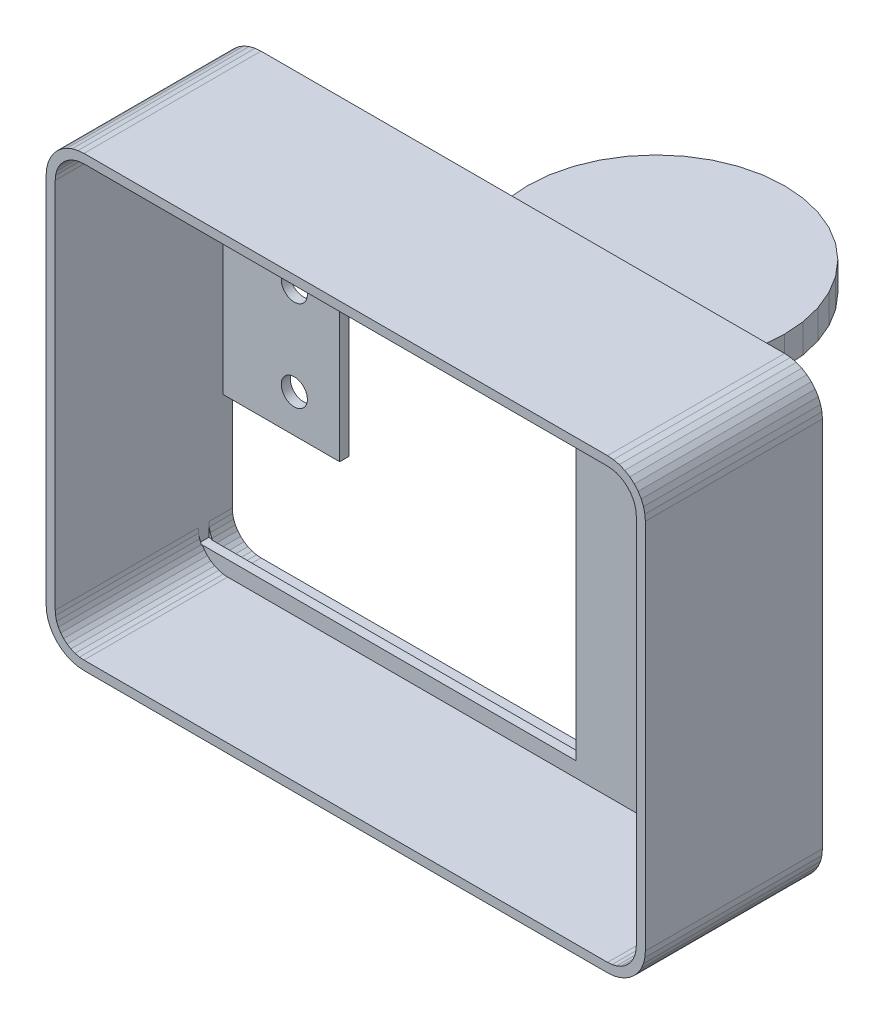
from build123d import *

# Parameters (mm, degrees)
BOSS_EXTRUDE1_START     = -23.4
BOSS_EXTRUDE1_DEPTH     = 23.4
CUT_EXTRUDE1_DEPTH      = 57.162977129
CUT_EXTRUDE1_DEPTH_BACK = 57.162977129
BOSS_EXTRUDE2_START     = -20.2
BOSS_EXTRUDE2_DEPTH     = 1.2
CUT_EXTRUDE2_START      = -20.3
SKETCH4_W               = 49.8
SKETCH4_H               = 38.8
CUT_EXTRUDE2_DEPTH      = 1.4
BOSS_EXTRUDE3_START     = -23.4
SKETCH5_W               = 15.4
SKETCH5_H               = 22
BOSS_EXTRUDE3_DEPTH     = 1.2
CUT_EXTRUDE3_DEPTH      = 57.162977129
CUT_EXTRUDE3_DEPTH_BACK = 57.162977129
SKETCH6_R               = 1.725
BOSS_EXTRUDE4_START     = 12.4
BOSS_EXTRUDE4_DEPTH     = 3.8
CUT_EXTRUDE4_START      = 13.65
CUT_EXTRUDE4_DEPTH      = 1.35


with BuildPart() as part:
    # Sketch1 → Boss-Extrude1 (new body)
    with BuildSketch(Plane.XY.offset(BOSS_EXTRUDE1_START)):
        Polygon((-41.6, -24.6), (-41.5384, -25.3822), (-41.3553, -26.1451), (-41.055, -26.87), (-40.6451, -27.5389), (-40.1355, -28.1355), (-39.5389, -28.6451), (-38.87, -29.055), (-38.1451, -29.3553), (-37.3822, -29.5384), (-36.6, -29.6), (32.6, -29.6), (33.3822, -29.5384), (34.1451, -29.3553), (34.87, -29.055), (35.5389, -28.6451), (36.1355, -28.1355), (36.6451, -27.5389), (37.055, -26.87), (37.3553, -26.1451), (37.5384, -25.3822), (37.6, -24.6), (37.6, 24.6), (37.5384, 25.3822), (37.3553, 26.1451), (37.055, 26.87), (36.6451, 27.5389), (36.1355, 28.1355), (35.5389, 28.6451), (34.87, 29.055), (34.1451, 29.3553), (33.3822, 29.5384), (32.6, 29.6), (-36.6, 29.6), (-37.3822, 29.5384), (-38.1451, 29.3553), (-38.87, 29.055), (-39.5389, 28.6451), (-40.1355, 28.1355), (-40.6451, 27.5389), (-41.055, 26.87), (-41.3553, 26.1451), (-41.5384, 25.3822), (-41.6, 24.6), align=None)
    extrude(amount=BOSS_EXTRUDE1_DEPTH)

    # Sketch2 → Cut-Extrude1 (cut, two sides: drawn at the far end of the back side and taken through both)
    with BuildSketch(Plane.XY.offset(-CUT_EXTRUDE1_DEPTH_BACK)):
        Polygon((-40.4, -24.6), (-40.3532, -25.1945), (-40.214, -25.7743), (-39.9858, -26.3252), (-39.6743, -26.8336), (-39.287, -27.287), (-38.8336, -27.6743), (-38.3252, -27.9858), (-37.7743, -28.214), (-37.1945, -28.3532), (-36.6, -28.4), (32.6, -28.4), (33.1945, -28.3532), (33.7743, -28.214), (34.3252, -27.9858), (34.8336, -27.6743), (35.287, -27.287), (35.6743, -26.8336), (35.9858, -26.3252), (36.214, -25.7743), (36.3532, -25.1945), (36.4, -24.6), (36.4, 24.6), (36.3532, 25.1945), (36.214, 25.7743), (35.9858, 26.3252), (35.6743, 26.8336), (35.287, 27.287), (34.8336, 27.6743), (34.3252, 27.9858), (33.7743, 28.214), (33.1945, 28.3532), (32.6, 28.4), (-36.6, 28.4), (-37.1945, 28.3532), (-37.7743, 28.214), (-38.3252, 27.9858), (-38.8336, 27.6743), (-39.287, 27.287), (-39.6743, 26.8336), (-39.9858, 26.3252), (-40.214, 25.7743), (-40.3532, 25.1945), (-40.4, 24.6), align=None)
    extrude(amount=CUT_EXTRUDE1_DEPTH + CUT_EXTRUDE1_DEPTH_BACK, mode=Mode.SUBTRACT)

    # Sketch3 → Boss-Extrude2 (add)
    with BuildSketch(Plane.XY.offset(BOSS_EXTRUDE2_START)):
        Polygon((-40.4, -24.6), (-40.3532, -25.1945), (-40.214, -25.7743), (-39.9858, -26.3252), (-39.6743, -26.8336), (-39.287, -27.287), (-38.8336, -27.6743), (-38.3252, -27.9858), (-37.7743, -28.214), (-37.1945, -28.3532), (-36.6, -28.4), (32.6, -28.4), (33.1945, -28.3532), (33.7743, -28.214), (34.3252, -27.9858), (34.8336, -27.6743), (35.287, -27.287), (35.6743, -26.8336), (35.9858, -26.3252), (36.214, -25.7743), (36.3532, -25.1945), (36.4, -24.6), (36.4, 24.6), (36.3532, 25.1945), (36.214, 25.7743), (35.9858, 26.3252), (35.6743, 26.8336), (35.287, 27.287), (34.8336, 27.6743), (34.3252, 27.9858), (33.7743, 28.214), (33.1945, 28.3532), (32.6, 28.4), (-36.6, 28.4), (-37.1945, 28.3532), (-37.7743, 28.214), (-38.3252, 27.9858), (-38.8336, 27.6743), (-39.287, 27.287), (-39.6743, 26.8336), (-39.9858, 26.3252), (-40.214, 25.7743), (-40.3532, 25.1945), (-40.4, 24.6), align=None)
    extrude(amount=BOSS_EXTRUDE2_DEPTH)

    # Sketch4 → Cut-Extrude2 (cut)
    with BuildSketch(Plane.XY.offset(CUT_EXTRUDE2_START)):
        with Locations((-15.5, -7)):
            Rectangle(SKETCH4_W, SKETCH4_H)
    extrude(amount=CUT_EXTRUDE2_DEPTH, mode=Mode.SUBTRACT)

    # Sketch5 → Boss-Extrude3 (add)
    with BuildSketch(Plane.XY.offset(BOSS_EXTRUDE3_START)):
        with Locations((-32.7, 0)):
            Rectangle(SKETCH5_W, SKETCH5_H)
    extrude(amount=BOSS_EXTRUDE3_DEPTH)

    # Sketch6 → Cut-Extrude3 (cut, two sides: drawn at the far end of the back side and taken through both)
    with BuildSketch(Plane.XY.offset(-CUT_EXTRUDE3_DEPTH_BACK)):
        with Locations((-31, 6)):
            Circle(SKETCH6_R)
        with Locations((-31, -6)):
            Circle(SKETCH6_R)
    extrude(amount=CUT_EXTRUDE3_DEPTH + CUT_EXTRUDE3_DEPTH_BACK, mode=Mode.SUBTRACT)

    # Sketch7 → Boss-Extrude4 (add)
    with BuildSketch(Plane(origin=(0, 0, 0), x_dir=(1, 0, 0), z_dir=(0, 1, 0)).offset(BOSS_EXTRUDE4_START)):
        Polygon((-17, 39), (-16.7907, 41.6594), (-16.168, 44.2533), (-15.1471, 46.7178), (-13.7533, 48.9923), (-12.0208, 51.0208), (-9.9923, 52.7533), (-7.7178, 54.1471), (-5.2533, 55.168), (-2.6594, 55.7907), (0, 56), (2.6594, 55.7907), (5.2533, 55.168), (7.7178, 54.1471), (9.9923, 52.7533), (12.0208, 51.0208), (13.7533, 48.9923), (15.1471, 46.7178), (16.168, 44.2533), (16.7907, 41.6594), (17, 39), (16.7907, 36.3406), (14.9754, 19.6871), (14.9021, 19.382), (14.782, 19.092), (14.618, 18.8244), (14.4142, 18.5858), (14.1756, 18.382), (13.908, 18.218), (13.618, 18.0979), (13.3129, 18.0246), (13, 18), (-13, 18), (-13.3129, 18.0246), (-13.618, 18.0979), (-13.908, 18.218), (-14.1756, 18.382), (-14.4142, 18.5858), (-14.618, 18.8244), (-14.782, 19.092), (-14.9021, 19.382), (-14.9754, 19.6871), (-16.7907, 36.3406), align=None)
    extrude(amount=BOSS_EXTRUDE4_DEPTH)

    # Sketch8 → Cut-Extrude4 (cut, symmetric)
    with BuildSketch(Plane(origin=(0, 0, 0), x_dir=(1, 0, 0), z_dir=(0, 1, 0)).offset(CUT_EXTRUDE4_START)):
        Polygon((-15.8, 39), (-15.6055, 41.4717), (-15.0267, 43.8825), (-14.0779, 46.173), (-12.7825, 48.287), (-11.1723, 50.1723), (-9.287, 51.7825), (-7.173, 53.0779), (-4.8825, 54.0267), (-2.4717, 54.6055), (0, 54.8), (2.4717, 54.6055), (4.8825, 54.0267), (7.173, 53.0779), (9.287, 51.7825), (11.1723, 50.1723), (12.7825, 48.287), (14.0779, 46.173), (15.0267, 43.8825), (15.6055, 41.4717), (15.8, 39), (15.6055, 36.5283), (13.7754, 18.6871), (13.7021, 18.382), (13.582, 18.092), (13.418, 17.8244), (13.2142, 17.5858), (12.9756, 17.382), (12.708, 17.218), (12.418, 17.0979), (12.1129, 17.0246), (11.8, 17), (-11.8, 17), (-12.1129, 17.0246), (-12.418, 17.0979), (-12.708, 17.218), (-12.9756, 17.382), (-13.2142, 17.5858), (-13.418, 17.8244), (-13.582, 18.092), (-13.7021, 18.382), (-13.7754, 18.6871), (-15.6055, 36.5283), align=None)
    extrude(amount=CUT_EXTRUDE4_DEPTH, both=True, mode=Mode.SUBTRACT)


solid = part.part
